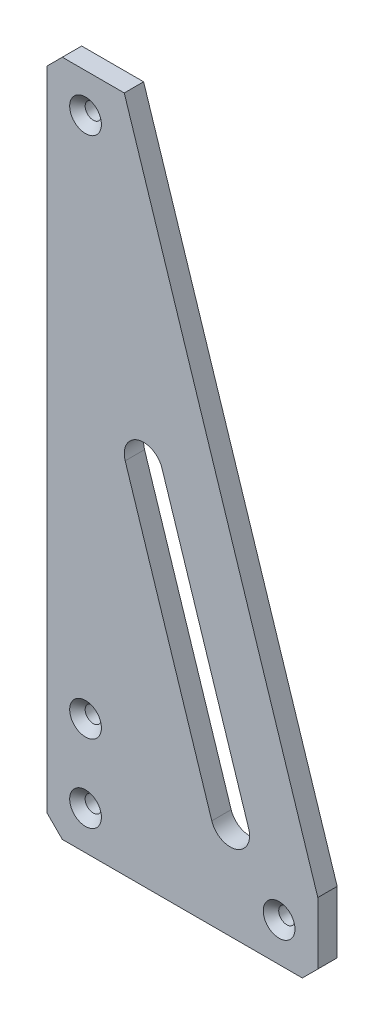
from build123d import *

# Parameters (mm, degrees)
SKETCH_1_R          = 2.1
EXTRUDE_1_DEPTH     = 2.5
CHAMFER_1_SIZE      = 4
CHAMFER_2_SIZE      = 2
CUT_EXTRUDE_1_DEPTH = 95.372930441


with BuildPart() as part:
    # 草图1 → 凸台-拉伸1 (new, symmetric)
    with BuildSketch(Plane.XY):
        Polygon((-35, 87.5), (-35, -87.5), (35, -87.5), (35, -67.5), (-15, 87.5), align=None)
        with Locations((-25, -77.5)):
            Circle(SKETCH_1_R, mode=Mode.SUBTRACT)
        with Locations((25, -77.5)):
            Circle(SKETCH_1_R, mode=Mode.SUBTRACT)
        with Locations((-25, 77.5)):
            Circle(SKETCH_1_R, mode=Mode.SUBTRACT)
        with Locations((-25, -57.5)):
            Circle(SKETCH_1_R, mode=Mode.SUBTRACT)
    extrude(amount=EXTRUDE_1_DEPTH, both=True)

    # 倒角1
    chamfer_1_edges = [part.edges().sort_by_distance(p)[0] for p in [
        (-35, -87.5, 0),
        (-35, 87.5, 0),
        (35, -87.5, 0),
    ]]
    chamfer(chamfer_1_edges, length=CHAMFER_1_SIZE)

    # 倒角2
    chamfer_2_edges = [part.edges().sort_by_distance(p)[0] for p in [
        (22.9, -77.5, 2.5),
        (-27.1, -77.5, 2.5),
        (-27.1, 77.5, 2.5),
        (-27.1, -57.5, 2.5),
    ]]
    chamfer(chamfer_2_edges, length=CHAMFER_2_SIZE)

    # 草图2 → 切除-拉伸1 (cut, through all)
    with BuildSketch(Plane(origin=(0, 0, -2.5), x_dir=(-1, 0, 0), z_dir=(0, 0, -1))):
        with BuildLine():
            Line((-17.130804412, -60.9649861), (5.241456911, 8.389024))
            ThreePointArc((5.241456911, 8.389024), (11.5350139, 11.612553189), (14.758543089, 5.318996201))
            Line((14.758543089, 5.318996201), (-7.613718234, -64.0350139))
            ThreePointArc((-7.613718234, -64.0350139), (-13.907275222, -67.258543089), (-17.130804412, -60.9649861))
        make_face()
    extrude(amount=-CUT_EXTRUDE_1_DEPTH, mode=Mode.SUBTRACT)


solid = part.part
